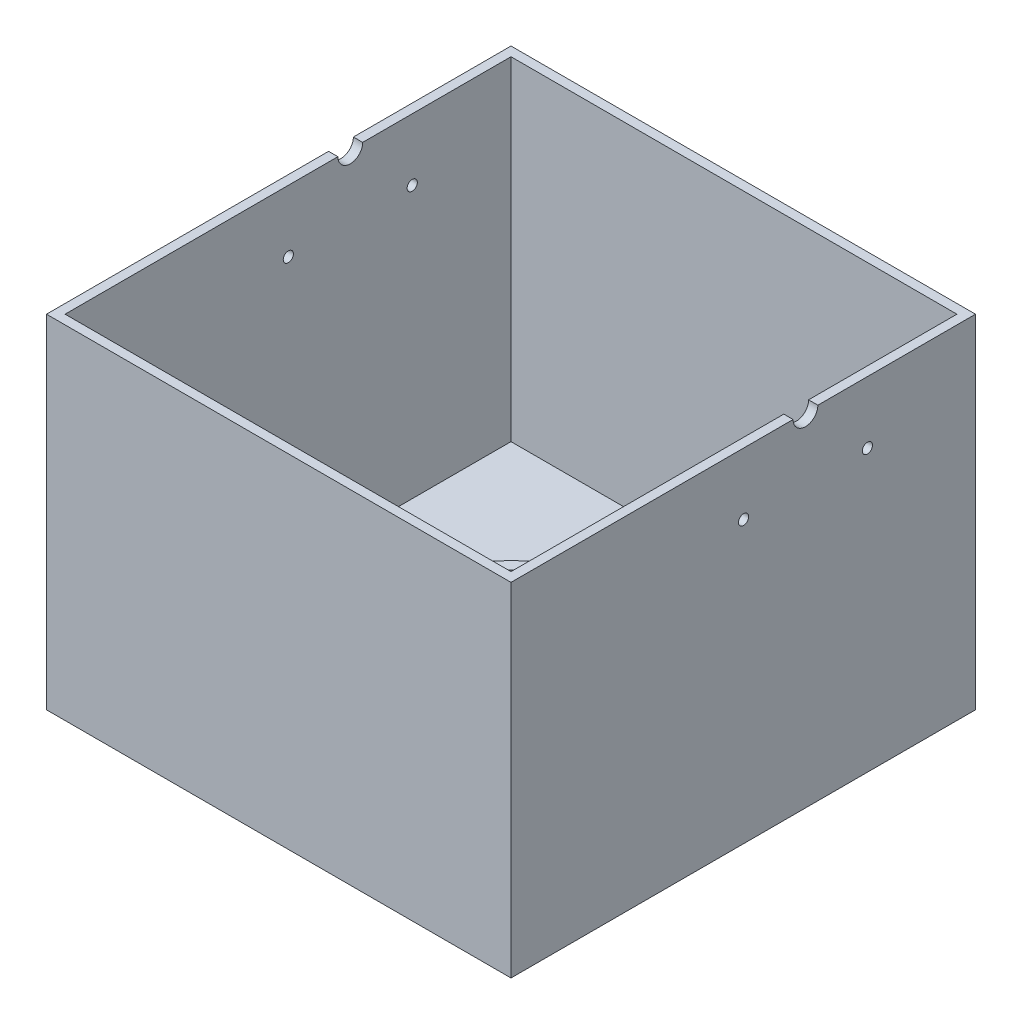
from build123d import *

# Parameters (mm, degrees)
SKETCH_1_W          = 150
SKETCH_1_H          = 150
EXTRUDE_1_DEPTH     = 3
SKETCH_2_W          = 150
SKETCH_2_H          = 150
SKETCH_2_W_2        = 144
SKETCH_2_H_2        = 144
EXTRUDE_2_DEPTH     = 107.65
SKETCH_3_R          = 27.5
CUT_EXTRUDE_1_DEPTH = 91
SKETCH_4_R          = 4
CUT_EXTRUDE_2_DEPTH = 201.9189451
SKETCH_8_R          = 35
SKETCH_8_R_2        = 31.25
EXTRUDE_4_DEPTH     = 14
SKETCH_9_R          = 1.65
CUT_EXTRUDE_3_DEPTH = 201.9189451


with BuildPart() as part:
    # 草图1 → 凸台-拉伸1 (new body)
    with BuildSketch(Plane(origin=(0, 0, 0), x_dir=(1, 0, 0), z_dir=(0, 1, 0))):
        Rectangle(SKETCH_1_W, SKETCH_1_H)
    extrude(amount=EXTRUDE_1_DEPTH)

    # 草图2 → 凸台-拉伸2 (add)
    with BuildSketch(Plane(origin=(0, 3, 0), x_dir=(1, 0, 0), z_dir=(0, 1, 0))):
        Rectangle(SKETCH_2_W, SKETCH_2_H)
        Rectangle(SKETCH_2_W_2, SKETCH_2_H_2, mode=Mode.SUBTRACT)
    extrude(amount=EXTRUDE_2_DEPTH)

    # 草图3 → 切除-拉伸1 (cut)
    with BuildSketch(Plane.XZ):
        with Locations(Location((0, 0, 0), (0, 0, 270))):
            Circle(SKETCH_3_R)
    extrude(amount=-CUT_EXTRUDE_1_DEPTH, mode=Mode.SUBTRACT)

    # 草图4 → 切除-拉伸2 (cut, through all)
    with BuildSketch(Plane.ZY.offset(75)):
        with Locations((-20.1, 110.65)):
            Circle(SKETCH_4_R)
    extrude(amount=-CUT_EXTRUDE_2_DEPTH, mode=Mode.SUBTRACT)

    # 草图8 → 凸台-拉伸4 (add)
    with BuildSketch(Plane(origin=(0, 3, 0), x_dir=(1, 0, 0), z_dir=(0, 1, 0))):
        with Locations(Location((0, 0, 0), (0, 0, 270))):
            Circle(SKETCH_8_R)
        with Locations(Location((0, 0, 0), (0, 0, 270))):
            Circle(SKETCH_8_R_2, mode=Mode.SUBTRACT)
    extrude(amount=EXTRUDE_4_DEPTH)

    # 草图9 → 切除-拉伸3 (cut, through all)
    with BuildSketch(Plane.ZY.offset(75)):
        with Locations((-40.1, 90.65)):
            Circle(SKETCH_9_R)
        with Locations((-0.1, 90.65)):
            Circle(SKETCH_9_R)
    extrude(amount=-CUT_EXTRUDE_3_DEPTH, mode=Mode.SUBTRACT)


solid = part.part
